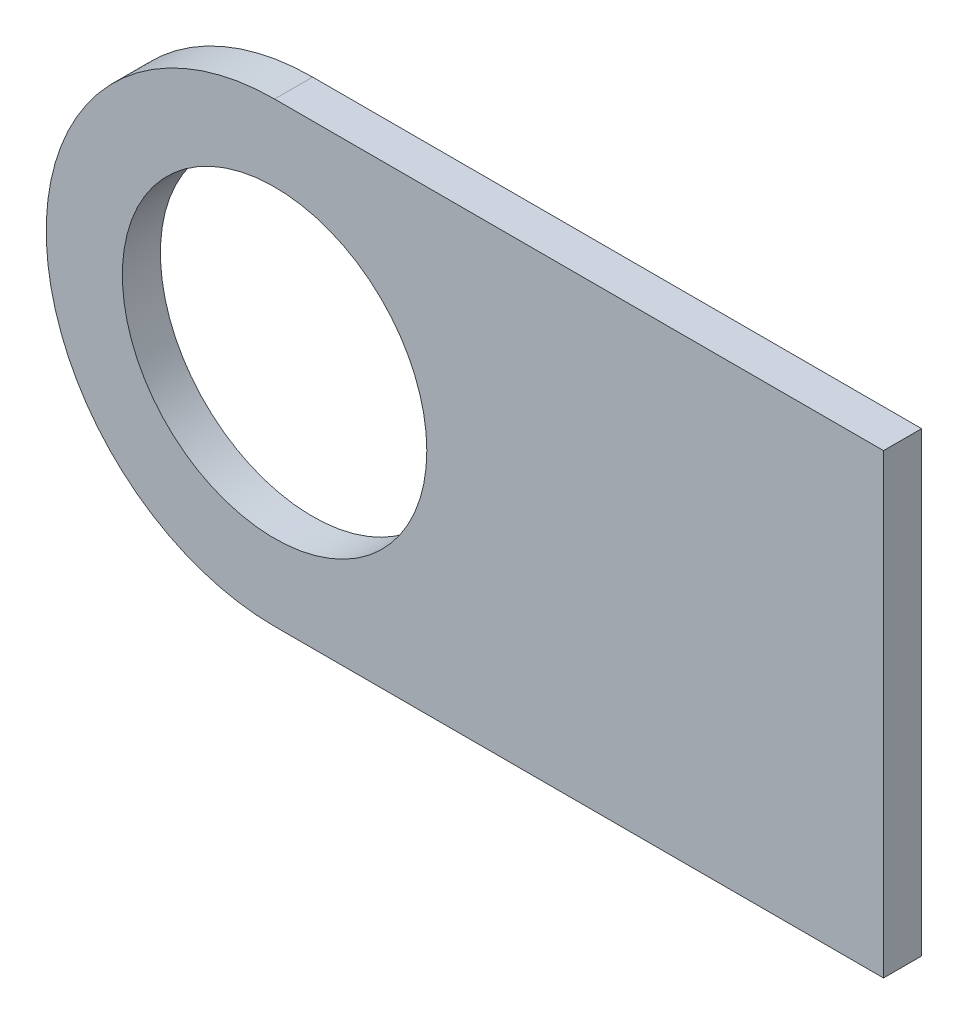
from build123d import *

# Parameters (mm, degrees)
FLAT_SKETCH_R      = 12.7
EXTRUDE_FACE_DEPTH = 3.175


with BuildPart() as part:
    # Flat sketch → Extrude face (new body)
    with BuildSketch(Plane.XY):
        with BuildLine():
            Line((0, -19.05), (50.8, -19.05))
            Line((50.8, -19.05), (50.8, 19.05))
            Line((50.8, 19.05), (0, 19.05))
            ThreePointArc((0, 19.05), (-19.05, 0), (0, -19.05))
        make_face()
        Circle(FLAT_SKETCH_R, mode=Mode.SUBTRACT)
    extrude(amount=EXTRUDE_FACE_DEPTH)


solid = part.part
